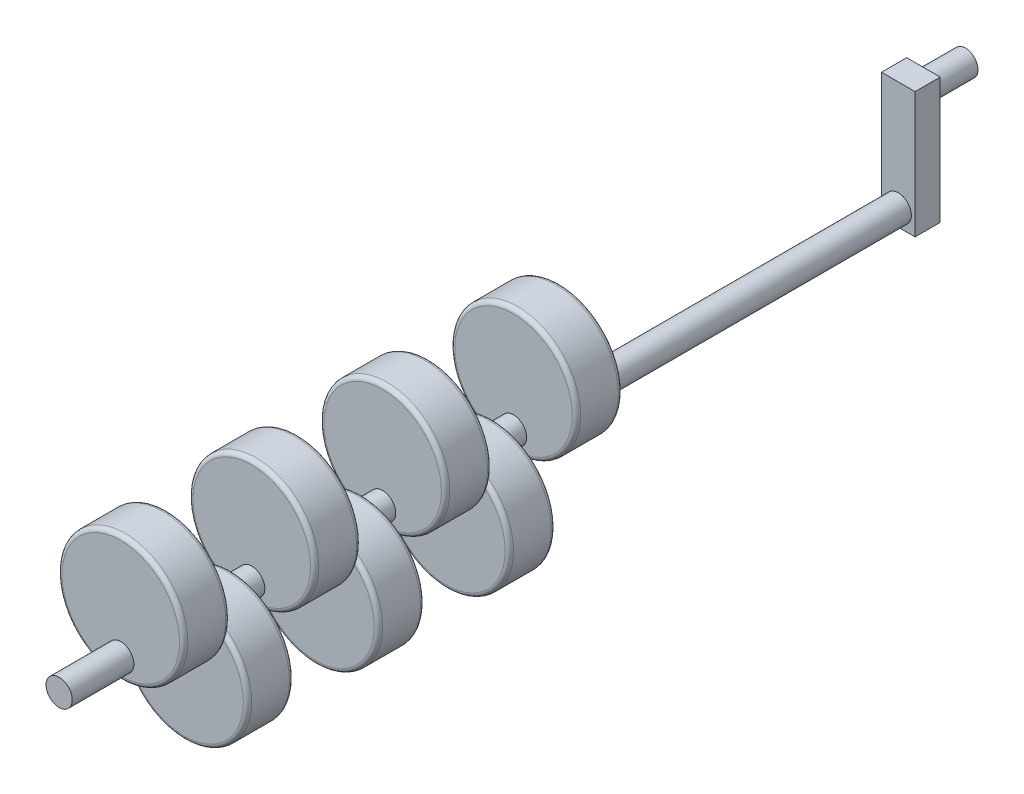
from build123d import *

# Parameters (mm, degrees)
SKETCH_1_R             = 1.5625
EXTRUDE_1_DEPTH        = 45
EXTRUDE_START          = -10.1
SKETCH_2_R             = 7.5
EXTRUDE_2_DEPTH        = 2.75
PATTERN_LINEAR_1_COUNT = 4
PATTERN_LINEAR_1_PITCH = 15.6
EXTRUDE_START_2        = -17.7
SKETCH_3_R             = 7.5
EXTRUDE_3_DEPTH        = 2.75
PATTERN_LINEAR_2_COUNT = 3
PATTERN_LINEAR_2_PITCH = 15.6
FILLET_1_R             = 0.5
SKETCH_4_R             = 1.5625
EXTRUDE_4_DEPTH        = 10
SKETCH_5_W             = 4
SKETCH_5_H             = 15
EXTRUDE_5_DEPTH        = 3
SKETCH_6_R             = 1.5
EXTRUDE_6_DEPTH        = 5


with BuildPart() as part:
    # 草图1 → 凸台-拉伸1 (new, symmetric)
    with BuildSketch(Plane.XY):
        with Locations(Location((0, 0, 0), (0, 0, 180))):
            Circle(SKETCH_1_R)
    extrude(amount=EXTRUDE_1_DEPTH, both=True)

    # 草图2 → 凸台-拉伸2 (add, symmetric)
    with BuildSketch(Plane.XY.offset(45).offset(EXTRUDE_START)):
        with Locations((0, 5)):
            Circle(SKETCH_2_R)
    extrude_2 = extrude(amount=EXTRUDE_2_DEPTH, both=True)

    # 阵列(线性)1: 凸台-拉伸2 ×4
    with Locations(*[(0, 0, -i * PATTERN_LINEAR_1_PITCH) for i in range(1, PATTERN_LINEAR_1_COUNT)]):
        add(extrude_2)

    # 草图3 → 凸台-拉伸3 (add, symmetric)
    with BuildSketch(Plane.XY.offset(45).offset(EXTRUDE_START_2)):
        with Locations((0, -5)):
            Circle(SKETCH_3_R)
    extrude_3 = extrude(amount=EXTRUDE_3_DEPTH, both=True)

    # 阵列(线性)2: 凸台-拉伸3 ×3
    with Locations(*[(0, 0, -i * PATTERN_LINEAR_2_PITCH) for i in range(1, PATTERN_LINEAR_2_COUNT)]):
        add(extrude_3)

    # 圆角1
    fillet_1_edges = [part.edges().sort_by_distance(p)[0] for p in [
        (-7.5, 5, 16.55),
        (-7.5, 5, 22.05),
        (-7.5, 5, 0.95),
        (-7.5, 5, 6.45),
        (-7.5, 5, -14.65),
        (-7.5, 5, -9.15),
        (-7.5, -5, 24.55),
        (-7.5, -5, 30.05),
        (-7.5, -5, 8.95),
        (-7.5, -5, 14.45),
        (-7.5, -5, -6.65),
        (-7.5, -5, -1.15),
        (-7.5, 5, 32.15),
        (-7.5, 5, 37.65),
    ]]
    fillet(fillet_1_edges, radius=FILLET_1_R)

    # 草图4 → 凸台-拉伸4 (add)
    with BuildSketch(Plane(origin=(0, 0, -45), x_dir=(-1, 0, 0), z_dir=(0, 0, -1))):
        Circle(SKETCH_4_R)
    extrude(amount=EXTRUDE_4_DEPTH)

    # 草图5 → 凸台-拉伸5 (add)
    with BuildSketch(Plane(origin=(0, 0, -55), x_dir=(-1, 0, 0), z_dir=(0, 0, -1))):
        with Locations((0, 5.5)):
            Rectangle(SKETCH_5_W, SKETCH_5_H)
    extrude(amount=EXTRUDE_5_DEPTH)

    # 草图6 → 凸台-拉伸6 (add)
    with BuildSketch(Plane(origin=(0, 0, -58), x_dir=(-1, 0, 0), z_dir=(0, 0, -1))):
        with Locations(Location((0, 11, 0), (0, 0, 180))):
            Circle(SKETCH_6_R)
    extrude(amount=EXTRUDE_6_DEPTH)


solid = part.part
